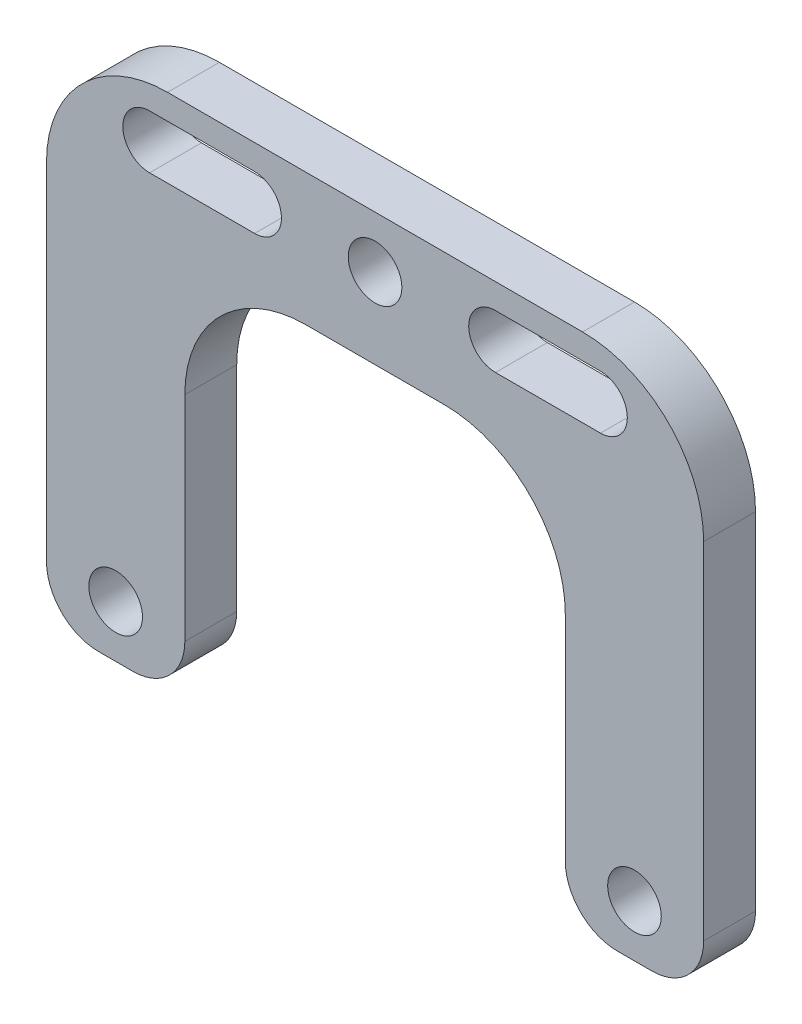
from build123d import *

# Parameters (mm, degrees)
SKETCH_1_W          = 38
SKETCH_1_H          = 30
EXTRUDE_1_DEPTH     = 3
SKETCH_2_R          = 1.55
CUT_EXTRUDE_1_DEPTH = 10
SKETCH_3_W          = 22
SKETCH_3_H          = 22.358896132
CUT_EXTRUDE_2_DEPTH = 10
FILLET_1_R          = 7
FILLET_2_R          = 7
FILLET_3_R          = 3


with BuildPart() as part:
    # 草图1 → 凸台-拉伸1 (new body)
    with BuildSketch(Plane.XY):
        Rectangle(SKETCH_1_W, SKETCH_1_H)
    extrude(amount=EXTRUDE_1_DEPTH)

    # 草图2 → 切除-拉伸1 (cut)
    with BuildSketch(Plane.XY.offset(3)):
        with Locations((0, 12)):
            Circle(SKETCH_2_R)
        with Locations((-15, -12)):
            Circle(SKETCH_2_R)
        with Locations((15, -12)):
            Circle(SKETCH_2_R)
        with BuildLine():
            Line((6.963744532, 13.55), (13.036255468, 13.55))
            ThreePointArc((13.036255468, 13.55), (14.586255468, 12), (13.036255468, 10.45))
            Line((13.036255468, 10.45), (6.963744532, 10.45))
            ThreePointArc((6.963744532, 10.45), (5.413744532, 12), (6.963744532, 13.55))
        make_face()
        with BuildLine():
            Line((-6.963744532, 13.55), (-13.036255468, 13.55))
            ThreePointArc((-13.036255468, 13.55), (-14.586255468, 12), (-13.036255468, 10.45))
            Line((-13.036255468, 10.45), (-6.963744532, 10.45))
            ThreePointArc((-6.963744532, 10.45), (-5.413744532, 12), (-6.963744532, 13.55))
        make_face()
    extrude(amount=-CUT_EXTRUDE_1_DEPTH, mode=Mode.SUBTRACT)

    # 草图3 → 切除-拉伸2 (cut)
    with BuildSketch(Plane.XY.offset(3)):
        with Locations((0, -3.820551934)):
            Rectangle(SKETCH_3_W, SKETCH_3_H)
    extrude(amount=-CUT_EXTRUDE_2_DEPTH, mode=Mode.SUBTRACT)

    # 圆角1
    fillet_1_edges = [part.edges().sort_by_distance(p)[0] for p in [
        (-19, 15, 1.5),
        (19, 15, 1.5),
    ]]
    fillet(fillet_1_edges, radius=FILLET_1_R)

    # 圆角2
    fillet_2_edges = [part.edges().sort_by_distance(p)[0] for p in [
        (11, 7.358896132, 1.5),
        (-11, 7.358896132, 1.5),
    ]]
    fillet(fillet_2_edges, radius=FILLET_2_R)

    # 圆角3
    fillet_3_edges = [part.edges().sort_by_distance(p)[0] for p in [
        (11, -15, 1.5),
        (-11, -15, 1.5),
        (19, -15, 1.5),
        (-19, -15, 1.5),
    ]]
    fillet(fillet_3_edges, radius=FILLET_3_R)


solid = part.part
